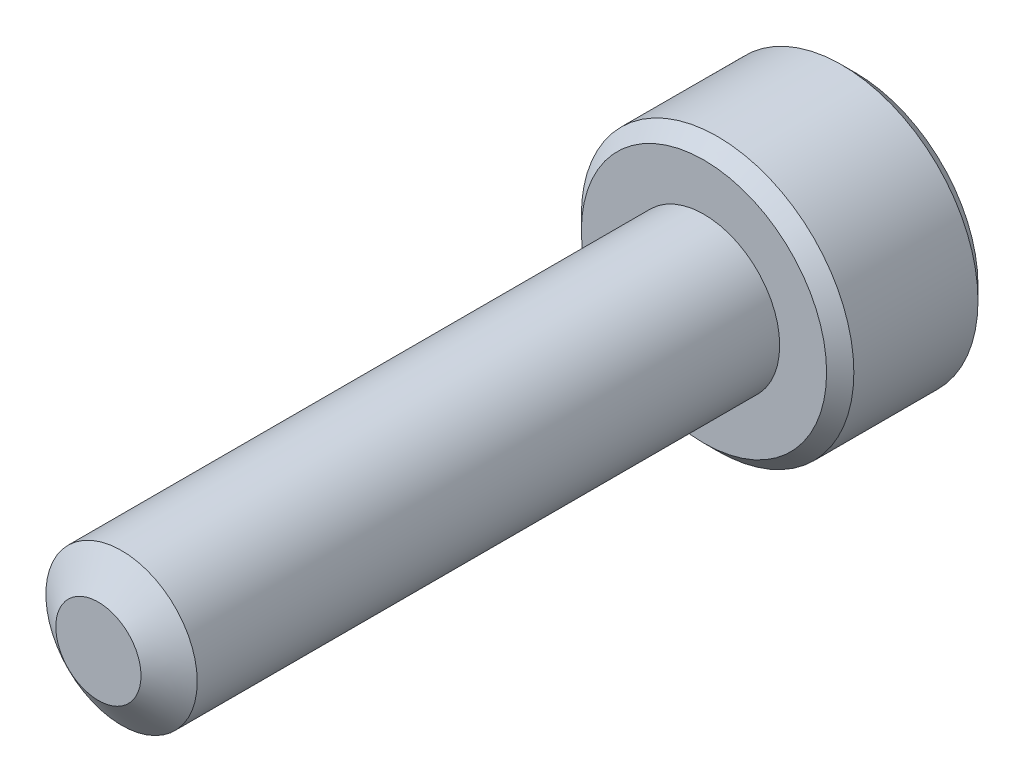
from build123d import *

# Parameters (mm, degrees)
SKETCH1_R          = 1.25
EXTRUDE1_DEPTH     = 10
SKETCH6_R          = 2.25
EXTRUDE2_DEPTH     = 2.5
CUT_EXTRUDE1_DEPTH = 1.5
CHAMFER1_SIZE      = 0.225


with BuildPart() as part:
    # Sketch1 → Extrude1 (new body)
    with BuildSketch(Plane.XY):
        Circle(SKETCH1_R)
    extrude(amount=-EXTRUDE1_DEPTH)

    # Sketch4 → Cut-Revolve1 (revolve, cut)
    with BuildSketch(Plane(origin=(0, 0, 0), x_dir=(0, 0, -1), z_dir=(1, 0, 0)), mode=Mode.PRIVATE) as cut_revolve1_sk:
        Polygon((0.382511876, 1.25), (0, 0.703716426), (0, 1.25), align=None)
    revolve(cut_revolve1_sk.sketch.rotate(Axis((0, 0, 0), (0, 0, -1)), 90), axis=Axis((0, 0, 0), (0, 0, -1)), mode=Mode.SUBTRACT)

    # Sketch6 → Extrude2 (add)
    with BuildSketch(Plane(origin=(0, 0, -10), x_dir=(-1, 0, 0), z_dir=(0, 0, -1))):
        with Locations(Location((0, 0, 0), (0, 0, 180))):
            Circle(SKETCH6_R)
    extrude(amount=EXTRUDE2_DEPTH)

    # Sketch7 → Cut-Extrude1 (cut)
    with BuildSketch(Plane(origin=(0, 0, -12.5), x_dir=(-1, 0, 0), z_dir=(0, 0, -1))):
        Polygon((0, 1.154700538), (-1, 0.577350269), (-1, -0.577350269), (0, -1.154700538), (1, -0.577350269), (1, 0.577350269), align=None)
    extrude(amount=-CUT_EXTRUDE1_DEPTH, mode=Mode.SUBTRACT)

    # Cut-Extrude2 cone 1 section (through the dimple's axis) → Cut-Extrude2 (revolve, cut)
    with BuildSketch(Plane(origin=(0, 0, -12.5), x_dir=(0, 1, 0), z_dir=(1, 0, 0))):
        Polygon((0, 0), (1.154700538, 0), (0, 1.154700538), align=None)
    revolve(axis=Axis((0, 0, -12.5), (0, 0, 1)), mode=Mode.SUBTRACT)

    # Chamfer1
    chamfer1_edges = [part.edges().sort_by_distance(p)[0] for p in [
        (-2.25, 0, -10),
        (-2.25, 0, -12.5),
    ]]
    chamfer(chamfer1_edges, length=CHAMFER1_SIZE)


solid = part.part
